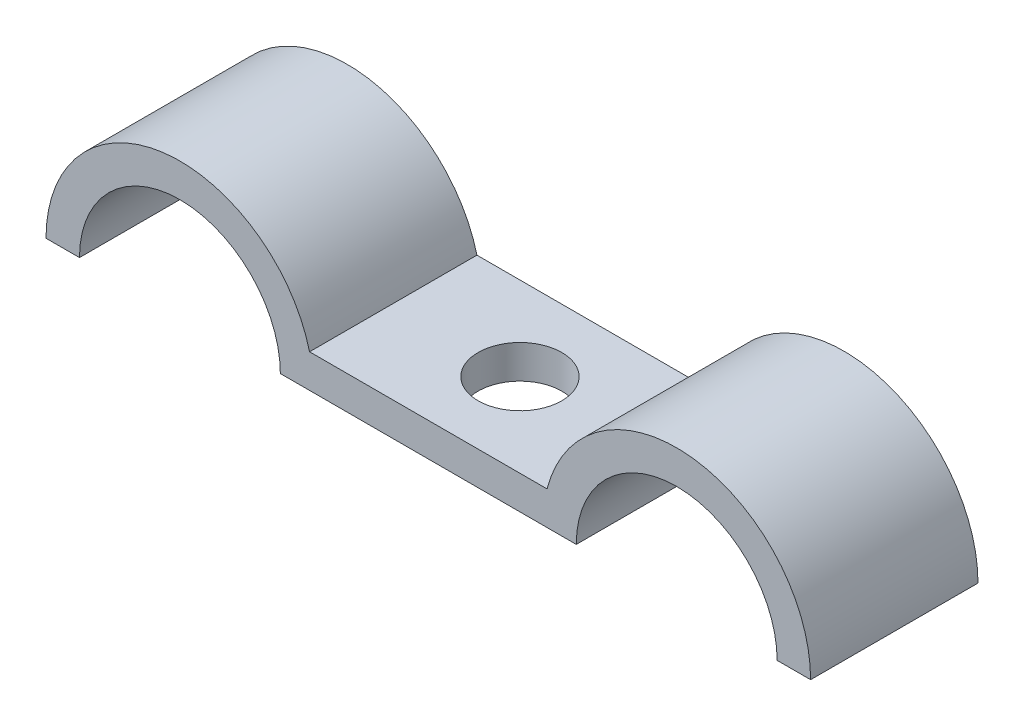
from build123d import *

# Parameters (mm, degrees)
Y_KSEKLIK_EKSTR_ZYON1_DEPTH = 10
KES_EKSTR_ZYON1_DEPTH       = 10
KES_EKSTR_ZYON1_DEPTH_BACK  = 5
IZIM2_R                     = 2.5


with BuildPart() as part:
    # Çizim1 → Yükseklik-Ekstrüzyon1 (new body)
    with BuildSketch(Plane.XY):
        with BuildLine():
            Line((0, 0), (17.68, 0))
            ThreePointArc((17.68, 0), (23.68, 6), (29.68, 0))
            Line((29.68, 0), (31.68, 0))
            ThreePointArc((31.68, 0), (24.68803434, 7.93623757), (15.934033308, 2))
            Line((15.934033308, 2), (1.745966692, 2))
            ThreePointArc((1.745966692, 2), (-7.00803434, 7.93623757), (-14, 0))
            Line((-14, 0), (-12, 0))
            ThreePointArc((-12, 0), (-6, 6), (0, 0))
        make_face()
    extrude(amount=Y_KSEKLIK_EKSTR_ZYON1_DEPTH)

    # Çizim2 → Kes-Ekstrüzyon1 (cut, two sides: drawn at the far end of the back side and taken through both)
    with BuildSketch(Plane(origin=(0, 2, 0), x_dir=(1, 0, 0), z_dir=(0, 1, 0)).offset(-KES_EKSTR_ZYON1_DEPTH_BACK)):
        with Locations((9.316, -5)):
            Circle(IZIM2_R)
    extrude(amount=KES_EKSTR_ZYON1_DEPTH + KES_EKSTR_ZYON1_DEPTH_BACK, mode=Mode.SUBTRACT)


solid = part.part
